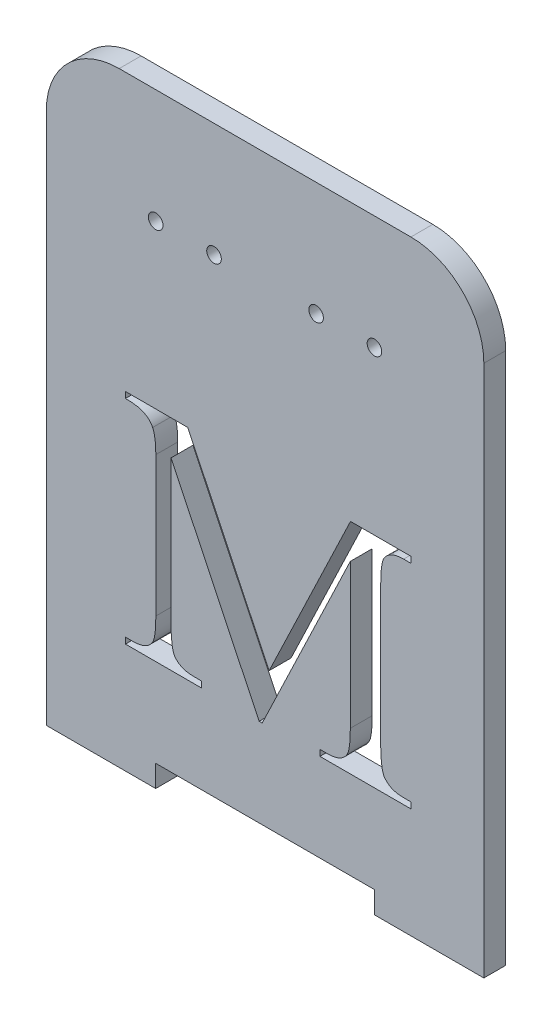
from build123d import *

# Parameters (mm, degrees)
BOSS_EXTRUDE1_DEPTH = 3
CUT_EXTRUDE1_DEPTH  = 3
SKETCH3_R           = 1
CUT_EXTRUDE2_DEPTH  = 3


with BuildPart() as part:
    # Sketch1 → Boss-Extrude1 (new body)
    with BuildSketch(Plane.XY):
        with BuildLine():
            Line((15, 0), (45, 0))
            Line((45, 0), (45, -3))
            Line((45, -3), (60, -3))
            Line((60, -3), (60, 0))
            Line((60, 0), (60, 70))
            ThreePointArc((60, 70), (57.071067812, 77.071067812), (50, 80))
            Line((50, 80), (10, 80))
            ThreePointArc((10, 80), (2.928932188, 77.071067812), (0, 70))
            Line((0, 70), (0, 0))
            Line((0, 0), (0, -3))
            Line((0, -3), (15, -3))
            Line((15, -3), (15, 0))
        make_face()
    extrude(amount=BOSS_EXTRUDE1_DEPTH)

    # Sketch2 → Cut-Extrude1 (cut)
    with BuildSketch(Plane.XY.offset(3)):
        with BuildLine():
            Line((29.19049781, 12.081147466), (17.107164477, 37.322032883))
            Line((17.107164477, 37.322032883), (17.107164477, 17.497814133))
            add(Edge.make_bspline(
                [(17.107164477, 17.497814133), (17.106856563, 17.267704948), (17.106272319, 16.831089584), (17.143554032, 16.210481556), (17.183991208, 15.655960439), (17.251147223, 15.170009562), (17.322412489, 14.747387769), (17.428594053, 14.398396218), (17.538951634, 14.108390436), (17.644805439, 13.95466925), (17.693101977, 13.884532883)],
                knots=[0, 0, 0, 0, 1.48973486, 2.826663046, 4.025252461, 5.088590954, 6.003687083, 6.795186099, 7.45029523, 8, 8, 8, 8], degree=3))
            add(Edge.make_bspline(
                [(17.693101977, 13.884532883), (17.840346266, 13.73471353), (18.140195748, 13.429620165), (18.742251873, 13.122863505), (19.450963165, 12.941254282), (19.961816932, 12.923746203), (20.232164477, 12.9144808)],
                knots=[0, 0, 0, 0, 0.893460505, 1.819450328, 2.846037184, 4, 4, 4, 4], degree=3))
            Line((20.232164477, 12.9144808), (21.273831144, 12.9144808))
            Line((21.273831144, 12.9144808), (21.273831144, 12.081147466))
            Line((21.273831144, 12.081147466), (10.857164477, 12.081147466))
            Line((10.857164477, 12.081147466), (10.857164477, 12.9144808))
            Line((10.857164477, 12.9144808), (11.898831144, 12.9144808))
            add(Edge.make_bspline(
                [(11.898831144, 12.9144808), (12.048825145, 12.917755098), (12.339180303, 12.924093413), (12.757070795, 12.986186233), (13.143145766, 13.072376691), (13.494447303, 13.206491265), (13.814309401, 13.373094257), (14.09832336, 13.583510491), (14.341505484, 13.83600194), (14.479050655, 14.023925059), (14.548570727, 14.118907883)],
                knots=[0, 0, 0, 0, 1.182386838, 2.288838982, 3.326958154, 4.296765023, 5.246416275, 6.164047556, 7.072046332, 8, 8, 8, 8], degree=3))
            add(Edge.make_bspline(
                [(14.548570727, 14.118907883), (14.587376699, 14.189630143), (14.672804719, 14.345319134), (14.767344621, 14.622115391), (14.841068835, 14.959225842), (14.914129522, 15.351610192), (14.965303143, 15.806218983), (14.991936983, 16.317094802), (15.023349157, 16.887654031), (15.023664816, 17.28725487), (15.023831144, 17.497814133)],
                knots=[0, 0, 0, 0, 0.561580455, 1.236271222, 2.028879402, 2.966584022, 4.017422664, 5.2149421, 6.532486222, 8, 8, 8, 8], degree=3))
            Line((15.023831144, 17.497814133), (15.023831144, 36.6644808))
            add(Edge.make_bspline(
                [(15.023831144, 36.6644808), (15.02055328, 36.988166413), (15.014467946, 37.589086891), (14.928768358, 38.415621701), (14.807342688, 39.104328259), (14.655869132, 39.495898491), (14.587633227, 39.6722933)],
                knots=[0, 0, 0, 0, 1.269100049, 2.356076937, 3.259444487, 4, 4, 4, 4], degree=3))
            add(Edge.make_bspline(
                [(14.587633227, 39.6722933), (14.530456066, 39.780881674), (14.412829383, 40.004273146), (14.162927878, 40.302631077), (13.844654076, 40.567219507), (13.462503112, 40.813691306), (12.979301958, 41.020762409), (12.378141387, 41.15502888), (11.658107064, 41.237530633), (11.137387273, 41.244216283), (10.857164477, 41.247814133)],
                knots=[0, 0, 0, 0, 0.685675889, 1.410594349, 2.160436148, 2.996293973, 3.94870651, 5.086176952, 6.431940446, 8, 8, 8, 8], degree=3))
            Line((10.857164477, 41.247814133), (10.857164477, 42.081147466))
            Line((10.857164477, 42.081147466), (19.398831144, 42.081147466))
            Line((19.398831144, 42.081147466), (30.55768531, 18.7738558))
            Line((30.55768531, 18.7738558), (41.716539477, 42.081147466))
            Line((41.716539477, 42.081147466), (50.023831144, 42.081147466))
            Line((50.023831144, 42.081147466), (50.023831144, 41.247814133))
            Line((50.023831144, 41.247814133), (49.001695727, 41.247814133))
            add(Edge.make_bspline(
                [(49.001695727, 41.247814133), (48.849510318, 41.244694592), (48.556943778, 41.238697479), (48.135006283, 41.175164667), (47.746219832, 41.091107105), (47.393177435, 40.955606693), (47.072846278, 40.789567822), (46.789193443, 40.576638492), (46.539300059, 40.328607353), (46.401580276, 40.138732081), (46.332424894, 40.04338705)],
                knots=[0, 0, 0, 0, 1.192663738, 2.292818382, 3.341598875, 4.305885976, 5.250132179, 6.162540657, 7.077327887, 8, 8, 8, 8], degree=3))
            add(Edge.make_bspline(
                [(46.332424894, 40.04338705), (46.293618922, 39.97266479), (46.208190902, 39.816975798), (46.113651, 39.540179542), (46.039926786, 39.20306909), (45.966866099, 38.810684741), (45.915692478, 38.35607595), (45.889058638, 37.845200131), (45.857646464, 37.274640902), (45.857330805, 36.875040062), (45.857164477, 36.6644808)],
                knots=[0, 0, 0, 0, 0.561580455, 1.236271222, 2.028879402, 2.966584022, 4.017422664, 5.2149421, 6.532486222, 8, 8, 8, 8], degree=3))
            Line((45.857164477, 36.6644808), (45.857164477, 17.497814133))
            add(Edge.make_bspline(
                [(45.857164477, 17.497814133), (45.856887283, 17.267711351), (45.856361328, 16.831108136), (45.893253556, 16.210418928), (45.934944838, 15.656159203), (45.99825562, 15.168982955), (46.081396816, 14.748408827), (46.183028471, 14.396778863), (46.302123125, 14.10774347), (46.412242488, 13.95460789), (46.462633227, 13.884532883)],
                knots=[0, 0, 0, 0, 1.486776415, 2.821049613, 4.017258766, 5.078485589, 5.994452933, 6.784380121, 7.443731031, 8, 8, 8, 8], degree=3))
            add(Edge.make_bspline(
                [(46.462633227, 13.884532883), (46.609751164, 13.734446531), (46.910693137, 13.427432419), (47.515250463, 13.125895229), (48.222218515, 12.940045729), (48.731216692, 12.923351845), (49.001695727, 12.9144808)],
                knots=[0, 0, 0, 0, 0.893634595, 1.828003868, 2.845812335, 4, 4, 4, 4], degree=3))
            Line((49.001695727, 12.9144808), (50.023831144, 12.9144808))
            Line((50.023831144, 12.9144808), (50.023831144, 12.081147466))
            Line((50.023831144, 12.081147466), (37.523831144, 12.081147466))
            Line((37.523831144, 12.081147466), (37.523831144, 12.9144808))
            Line((37.523831144, 12.9144808), (38.56549781, 12.9144808))
            add(Edge.make_bspline(
                [(38.56549781, 12.9144808), (38.717654175, 12.917695974), (39.010164878, 12.923876936), (39.430396151, 12.985823667), (39.817804477, 13.074062693), (40.171351147, 13.203103474), (40.488581605, 13.375227668), (40.771335549, 13.583465527), (41.01486323, 13.834271299), (41.148211479, 14.02369587), (41.215237394, 14.118907883)],
                knots=[0, 0, 0, 0, 1.198333024, 2.303717216, 3.340834392, 4.325725627, 5.259386468, 6.176132048, 7.08325442, 8, 8, 8, 8], degree=3))
            add(Edge.make_bspline(
                [(41.215237394, 14.118907883), (41.254043366, 14.189630143), (41.339471385, 14.345319134), (41.434011288, 14.622115391), (41.507735502, 14.959225842), (41.580796189, 15.351610192), (41.631969809, 15.806218983), (41.658603649, 16.317094802), (41.690015823, 16.887654031), (41.690331482, 17.28725487), (41.69049781, 17.497814133)],
                knots=[0, 0, 0, 0, 0.561580455, 1.236271222, 2.028879402, 2.966584022, 4.017422664, 5.2149421, 6.532486222, 8, 8, 8, 8], degree=3))
            Line((41.69049781, 17.497814133), (41.69049781, 37.322032883))
            Line((41.69049781, 37.322032883), (29.607164477, 12.081147466))
            Line((29.607164477, 12.081147466), (29.19049781, 12.081147466))
        make_face()
    extrude(amount=-CUT_EXTRUDE1_DEPTH, mode=Mode.SUBTRACT)

    # Sketch3 → Cut-Extrude2 (cut)
    with BuildSketch(Plane.XY.offset(3)):
        with Locations((15, 64.377519573)):
            Circle(SKETCH3_R)
        with Locations((45, 64.377519573)):
            Circle(SKETCH3_R)
        with Locations((23, 64.377519573)):
            Circle(SKETCH3_R)
        with Locations((37, 64.377519573)):
            Circle(SKETCH3_R)
    extrude(amount=-CUT_EXTRUDE2_DEPTH, mode=Mode.SUBTRACT)


solid = part.part
